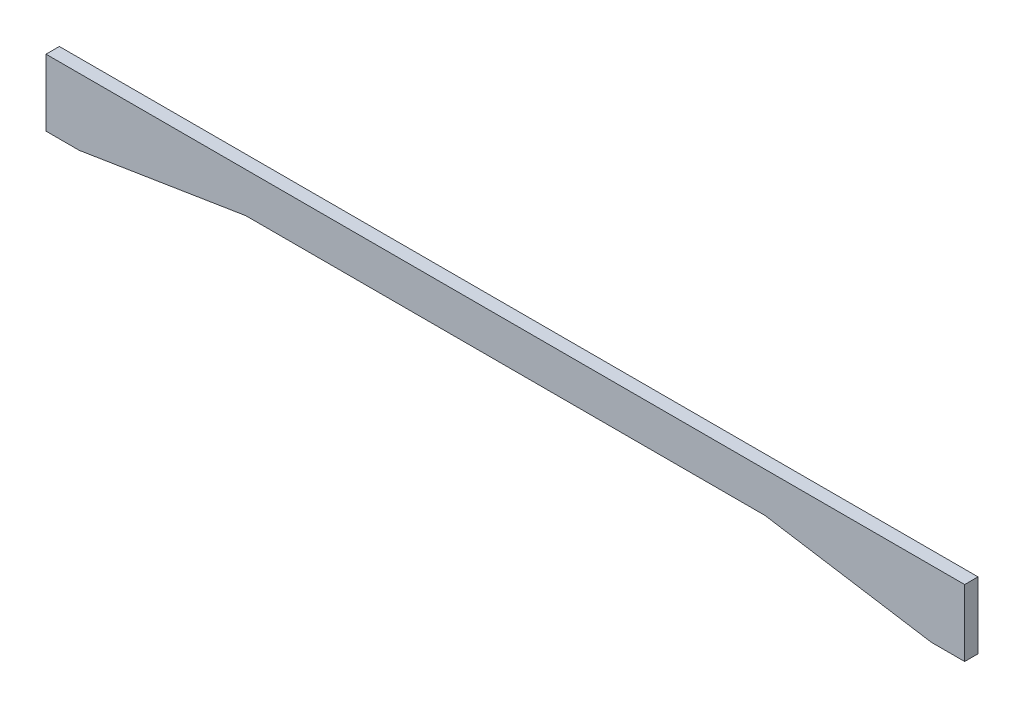
from build123d import *

# Parameters (mm, degrees)
BOSS_EXTRUDE1_DEPTH = 4


with BuildPart() as part:
    # Sketch1 → Boss-Extrude1 (new body)
    with BuildSketch(Plane.XY):
        Polygon((0, 0), (-77.852222873, 0), (-127.75, -8), (-137.75, -8), (-137.75, 12), (0, 12), align=None)
    boss_extrude1 = extrude(amount=BOSS_EXTRUDE1_DEPTH)

    # Mirror1: Boss-Extrude1 across plane
    add(boss_extrude1.mirror(Plane(origin=(0, 0, 4), x_dir=(0, 0, 1), z_dir=(1, 0, 0))))


solid = part.part
